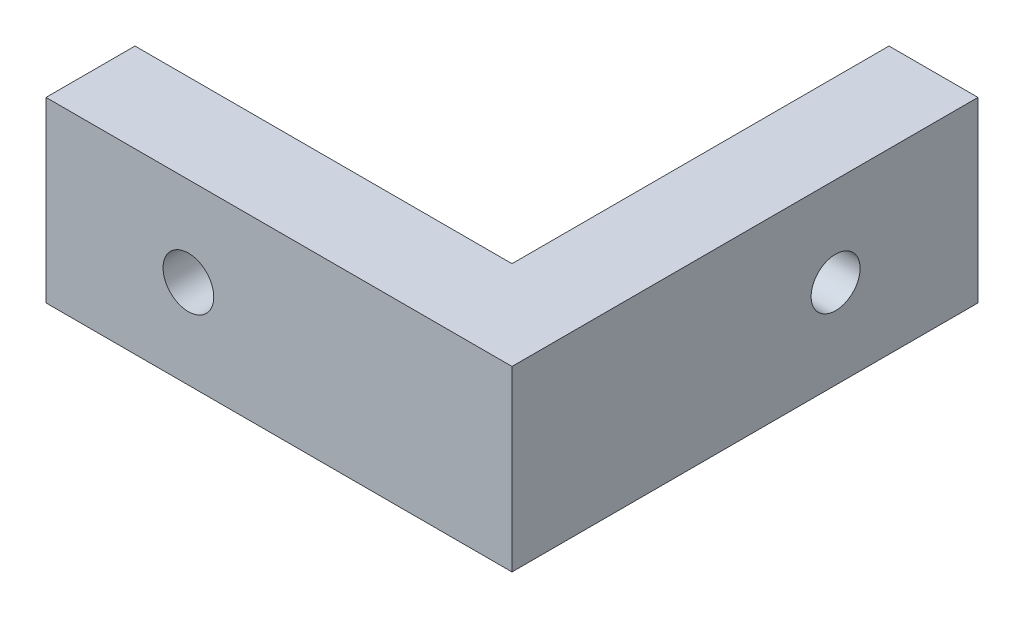
from build123d import *

# Parameters (mm, degrees)
BOSS_EXTRUDE1_DEPTH = 10
CUT_EXTRUDE2_REACH  = 40.351
SKETCH3_R           = 1.425
CUT_EXTRUDE3_REACH  = 40.351
SKETCH4_R           = 1.375


with BuildPart() as part:
    # Sketch2 → Boss-Extrude1 (new body)
    with BuildSketch(Plane(origin=(0, 0, 0), x_dir=(1, 0, 0), z_dir=(0, 1, 0))):
        Polygon((0, 0), (-26.18, 0), (-26.18, 5), (-5, 5), (-5, 26.18), (0, 26.18), align=None)
    extrude(amount=BOSS_EXTRUDE1_DEPTH)

    # Sketch3 → Cut-Extrude2 (cut, up to next)
    with BuildSketch(Plane.XY, mode=Mode.PRIVATE) as cut_extrude2_sk1:
        with Locations((-18.18, 5)):
            Circle(SKETCH3_R)
    cut_extrude2_tool1 = extrude(cut_extrude2_sk1.sketch, amount=-CUT_EXTRUDE2_REACH, mode=Mode.PRIVATE) & part.part
    add(cut_extrude2_tool1.solids().sort_by_distance((-18.18, 5, 0))[0], mode=Mode.SUBTRACT)

    # Sketch4 → Cut-Extrude3 (cut, up to next)
    with BuildSketch(Plane(origin=(0, 0, 0), x_dir=(0, 0, -1), z_dir=(1, 0, 0)), mode=Mode.PRIVATE) as cut_extrude3_sk1:
        with Locations((18.18, 5)):
            Circle(SKETCH4_R)
    cut_extrude3_tool1 = extrude(cut_extrude3_sk1.sketch, amount=-CUT_EXTRUDE3_REACH, mode=Mode.PRIVATE) & part.part
    add(cut_extrude3_tool1.solids().sort_by_distance((0, 5, -18.18))[0], mode=Mode.SUBTRACT)


solid = part.part
